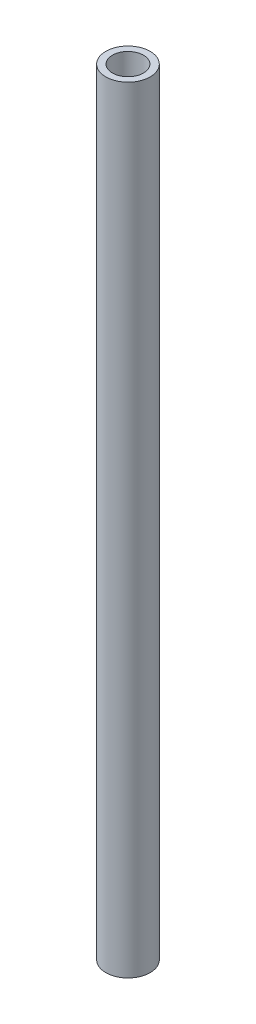
from build123d import *

# Parameters (mm, degrees)
SKETCH_1_R      = 10
SKETCH_1_R_2    = 7
EXTRUDE_1_DEPTH = 350


with BuildPart() as part:
    # 草图1 → 拉伸-薄壁1 (new body)
    with BuildSketch(Plane(origin=(0, 0, 0), x_dir=(1, 0, 0), z_dir=(0, 1, 0))):
        Circle(SKETCH_1_R)
        Circle(SKETCH_1_R_2, mode=Mode.SUBTRACT)
    extrude(amount=EXTRUDE_1_DEPTH)


solid = part.part
